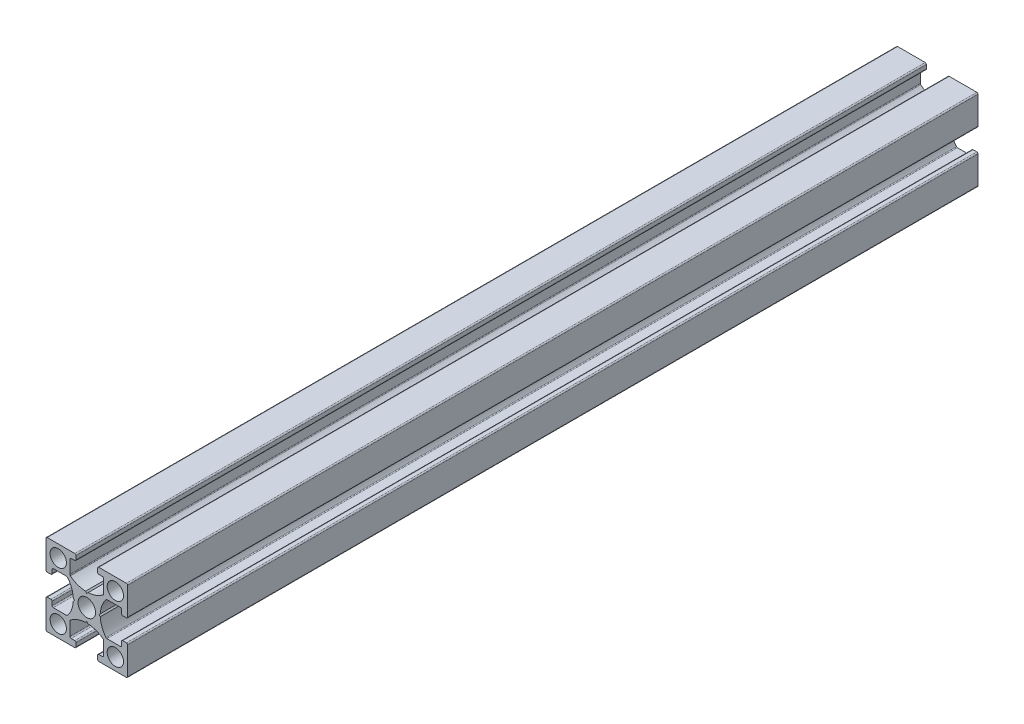
from build123d import *

# Parameters (mm, degrees)
MODEL_R         = 2.15
MODEL_R_2       = 2
EXTRUDE_1_DEPTH = 208.5


with BuildPart() as part:
    # Model → 보스-돌출1 (new body)
    with BuildSketch(Plane.XY):
        with BuildLine():
            Line((2307.763927197, 1192.134297913), (2307.763927197, 1195.391548465))
            ThreePointArc((2307.763927197, 1195.391548465), (2307.676059232, 1195.603680499), (2307.463927197, 1195.691548465))
            Line((2307.463927197, 1195.691548465), (2306.563927197, 1195.691548465))
            ThreePointArc((2306.563927197, 1195.691548465), (2306.351795163, 1195.779416431), (2306.263927197, 1195.991548465))
            Line((2306.263927197, 1195.991548465), (2306.263927197, 1196.891548465))
            ThreePointArc((2306.263927197, 1196.891548465), (2306.351795163, 1197.103680499), (2306.563927197, 1197.191548465))
            Line((2306.563927197, 1197.191548465), (2313.313927197, 1197.191548465))
            ThreePointArc((2313.313927197, 1197.191548465), (2313.526059232, 1197.103680499), (2313.613927197, 1196.891548465))
            Line((2313.613927197, 1196.891548465), (2313.613927197, 1190.141548465))
            ThreePointArc((2313.613927197, 1190.141548465), (2313.526059232, 1189.929416431), (2313.313927197, 1189.841548465))
            Line((2313.313927197, 1189.841548465), (2312.413927197, 1189.841548465))
            ThreePointArc((2312.413927197, 1189.841548465), (2312.201795163, 1189.929416431), (2312.113927197, 1190.141548465))
            Line((2312.113927197, 1190.141548465), (2312.113927197, 1191.041548465))
            ThreePointArc((2312.113927197, 1191.041548465), (2312.026059232, 1191.253680499), (2311.813927197, 1191.341548465))
            Line((2311.813927197, 1191.341548465), (2308.556676645, 1191.341548465))
            ThreePointArc((2308.556676645, 1191.341548465), (2308.426234796, 1191.311705686), (2308.321744595, 1191.228114625))
            ThreePointArc((2308.321744595, 1191.228114625), (2307.328306374, 1189.47356999), (2306.921204563, 1187.498825831))
            Line((2306.921204563, 1187.498825831), (2306.613927197, 1187.191548465))
            Line((2306.613927197, 1187.191548465), (2306.921204563, 1186.884271099))
            ThreePointArc((2306.921204563, 1186.884271099), (2307.328306374, 1184.90952694), (2308.321744595, 1183.154982305))
            ThreePointArc((2308.321744595, 1183.154982305), (2308.426234796, 1183.071391244), (2308.556676645, 1183.041548465))
            Line((2308.556676645, 1183.041548465), (2311.813927197, 1183.041548465))
            ThreePointArc((2311.813927197, 1183.041548465), (2312.026059232, 1183.129416431), (2312.113927197, 1183.341548465))
            Line((2312.113927197, 1183.341548465), (2312.113927197, 1184.241548465))
            ThreePointArc((2312.113927197, 1184.241548465), (2312.201795163, 1184.453680499), (2312.413927197, 1184.541548465))
            Line((2312.413927197, 1184.541548465), (2313.313927197, 1184.541548465))
            ThreePointArc((2313.313927197, 1184.541548465), (2313.526059232, 1184.453680499), (2313.613927197, 1184.241548465))
            Line((2313.613927197, 1184.241548465), (2313.613927197, 1177.491548465))
            ThreePointArc((2313.613927197, 1177.491548465), (2313.526059232, 1177.279416431), (2313.313927197, 1177.191548465))
            Line((2313.313927197, 1177.191548465), (2306.563927197, 1177.191548465))
            ThreePointArc((2306.563927197, 1177.191548465), (2306.351795163, 1177.279416431), (2306.263927197, 1177.491548465))
            Line((2306.263927197, 1177.491548465), (2306.263927197, 1178.391548465))
            ThreePointArc((2306.263927197, 1178.391548465), (2306.351795163, 1178.603680499), (2306.563927197, 1178.691548465))
            Line((2306.563927197, 1178.691548465), (2307.463927197, 1178.691548465))
            ThreePointArc((2307.463927197, 1178.691548465), (2307.676059232, 1178.779416431), (2307.763927197, 1178.991548465))
            Line((2307.763927197, 1178.991548465), (2307.763927197, 1182.248799017))
            ThreePointArc((2307.763927197, 1182.248799017), (2307.734084418, 1182.379240866), (2307.650493357, 1182.483731067))
            ThreePointArc((2307.650493357, 1182.483731067), (2305.895948722, 1183.477169289), (2303.921204563, 1183.884271099))
            Line((2303.921204563, 1183.884271099), (2303.613927197, 1184.191548465))
            Line((2303.613927197, 1184.191548465), (2303.306649831, 1183.884271099))
            ThreePointArc((2303.306649831, 1183.884271099), (2301.331905673, 1183.477169289), (2299.577361038, 1182.483731067))
            ThreePointArc((2299.577361038, 1182.483731067), (2299.493769977, 1182.379240866), (2299.463927197, 1182.248799017))
            Line((2299.463927197, 1182.248799017), (2299.463927197, 1178.991548465))
            ThreePointArc((2299.463927197, 1178.991548465), (2299.551795163, 1178.779416431), (2299.763927197, 1178.691548465))
            Line((2299.763927197, 1178.691548465), (2300.663927197, 1178.691548465))
            ThreePointArc((2300.663927197, 1178.691548465), (2300.876059232, 1178.603680499), (2300.963927197, 1178.391548465))
            Line((2300.963927197, 1178.391548465), (2300.963927197, 1177.491548465))
            ThreePointArc((2300.963927197, 1177.491548465), (2300.876059232, 1177.279416431), (2300.663927197, 1177.191548465))
            Line((2300.663927197, 1177.191548465), (2293.913927197, 1177.191548465))
            ThreePointArc((2293.913927197, 1177.191548465), (2293.701795163, 1177.279416431), (2293.613927197, 1177.491548465))
            Line((2293.613927197, 1177.491548465), (2293.613927197, 1184.241548465))
            ThreePointArc((2293.613927197, 1184.241548465), (2293.701795163, 1184.453680499), (2293.913927197, 1184.541548465))
            Line((2293.913927197, 1184.541548465), (2294.813927197, 1184.541548465))
            ThreePointArc((2294.813927197, 1184.541548465), (2295.026059232, 1184.453680499), (2295.113927197, 1184.241548465))
            Line((2295.113927197, 1184.241548465), (2295.113927197, 1183.341548465))
            ThreePointArc((2295.113927197, 1183.341548465), (2295.201795163, 1183.129416431), (2295.413927197, 1183.041548465))
            Line((2295.413927197, 1183.041548465), (2298.671177749, 1183.041548465))
            ThreePointArc((2298.671177749, 1183.041548465), (2298.801619599, 1183.071391244), (2298.906109799, 1183.154982305))
            ThreePointArc((2298.906109799, 1183.154982305), (2299.899548021, 1184.90952694), (2300.306649831, 1186.884271099))
            Line((2300.306649831, 1186.884271099), (2300.613927197, 1187.191548465))
            Line((2300.613927197, 1187.191548465), (2300.306649831, 1187.498825831))
            ThreePointArc((2300.306649831, 1187.498825831), (2299.899548021, 1189.47356999), (2298.906109799, 1191.228114625))
            ThreePointArc((2298.906109799, 1191.228114625), (2298.801619599, 1191.311705686), (2298.671177749, 1191.341548465))
            Line((2298.671177749, 1191.341548465), (2295.413927197, 1191.341548465))
            ThreePointArc((2295.413927197, 1191.341548465), (2295.201795163, 1191.253680499), (2295.113927197, 1191.041548465))
            Line((2295.113927197, 1191.041548465), (2295.113927197, 1190.141548465))
            ThreePointArc((2295.113927197, 1190.141548465), (2295.026059232, 1189.929416431), (2294.813927197, 1189.841548465))
            Line((2294.813927197, 1189.841548465), (2293.913927197, 1189.841548465))
            ThreePointArc((2293.913927197, 1189.841548465), (2293.701795163, 1189.929416431), (2293.613927197, 1190.141548465))
            Line((2293.613927197, 1190.141548465), (2293.613927197, 1196.891548465))
            ThreePointArc((2293.613927197, 1196.891548465), (2293.701795163, 1197.103680499), (2293.913927197, 1197.191548465))
            Line((2293.913927197, 1197.191548465), (2300.663927197, 1197.191548465))
            ThreePointArc((2300.663927197, 1197.191548465), (2300.876059232, 1197.103680499), (2300.963927197, 1196.891548465))
            Line((2300.963927197, 1196.891548465), (2300.963927197, 1195.991548465))
            ThreePointArc((2300.963927197, 1195.991548465), (2300.876059232, 1195.779416431), (2300.663927197, 1195.691548465))
            Line((2300.663927197, 1195.691548465), (2299.763927197, 1195.691548465))
            ThreePointArc((2299.763927197, 1195.691548465), (2299.551795163, 1195.603680499), (2299.463927197, 1195.391548465))
            Line((2299.463927197, 1195.391548465), (2299.463927197, 1192.134297913))
            ThreePointArc((2299.463927197, 1192.134297913), (2299.493769977, 1192.003856063), (2299.577361038, 1191.899365863))
            ThreePointArc((2299.577361038, 1191.899365863), (2301.331905673, 1190.905927641), (2303.306649831, 1190.498825831))
            Line((2303.306649831, 1190.498825831), (2303.613927197, 1190.191548465))
            Line((2303.613927197, 1190.191548465), (2303.921204563, 1190.498825831))
            ThreePointArc((2303.921204563, 1190.498825831), (2305.895948722, 1190.905927641), (2307.650493357, 1191.899365863))
            ThreePointArc((2307.650493357, 1191.899365863), (2307.734084418, 1192.003856063), (2307.763927197, 1192.134297913))
        make_face()
        with Locations((2303.613927197, 1187.191548465)):
            Circle(MODEL_R, mode=Mode.SUBTRACT)
        with Locations((2296.613927197, 1194.191548465)):
            Circle(MODEL_R_2, mode=Mode.SUBTRACT)
        with Locations((2296.613927197, 1180.191548465)):
            Circle(MODEL_R_2, mode=Mode.SUBTRACT)
        with Locations((2310.613927197, 1194.191548465)):
            Circle(MODEL_R_2, mode=Mode.SUBTRACT)
        with Locations((2310.613927197, 1180.191548465)):
            Circle(MODEL_R_2, mode=Mode.SUBTRACT)
    extrude(amount=EXTRUDE_1_DEPTH)


solid = part.part
